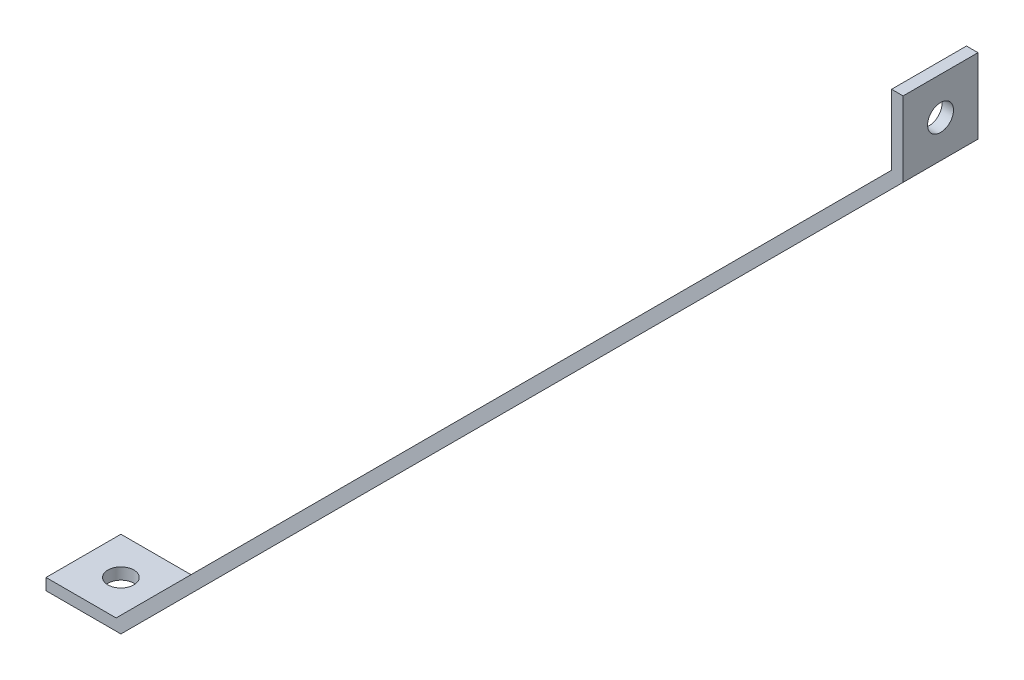
from build123d import *

# Parameters (mm, degrees)
EXTRUDE_THIN1_DEPTH = 20.6375
SKETCH2_R           = 7.14375
CUT_EXTRUDE1_DEPTH  = 533.454292692
SKETCH3_R           = 7.14375
CUT_EXTRUDE2_DEPTH  = 533.454292692


with BuildPart() as part:
    # Sketch1 → Extrude-Thin1 (new, symmetric)
    with BuildSketch(Plane.XY):
        Polygon((-256.801146906, -215.526146906), (-215.526146906, -215.526146906), (215.526146906, 215.526146906), (215.526146906, 256.801146906), (209.176146906, 256.801146906), (209.176146906, 218.156403027), (-218.156403027, -209.176146906), (-256.801146906, -209.176146906), align=None)
    extrude(amount=EXTRUDE_THIN1_DEPTH, both=True)

    # Sketch2 → Cut-Extrude1 (cut, through all)
    with BuildSketch(Plane(origin=(0, -209.176146906, 0), x_dir=(1, 0, 0), z_dir=(0, 1, 0))):
        with Locations(Location((-236.163646906, 0, 0), (0, 0, 270))):
            Circle(SKETCH2_R)
    extrude(amount=-CUT_EXTRUDE1_DEPTH, mode=Mode.SUBTRACT)

    # Sketch3 → Cut-Extrude2 (cut, through all)
    with BuildSketch(Plane.ZY.offset(-209.176146906)):
        with Locations(Location((0, 236.163646906, 0), (0, 0, 270))):
            Circle(SKETCH3_R)
    extrude(amount=-CUT_EXTRUDE2_DEPTH, mode=Mode.SUBTRACT)


solid = part.part
